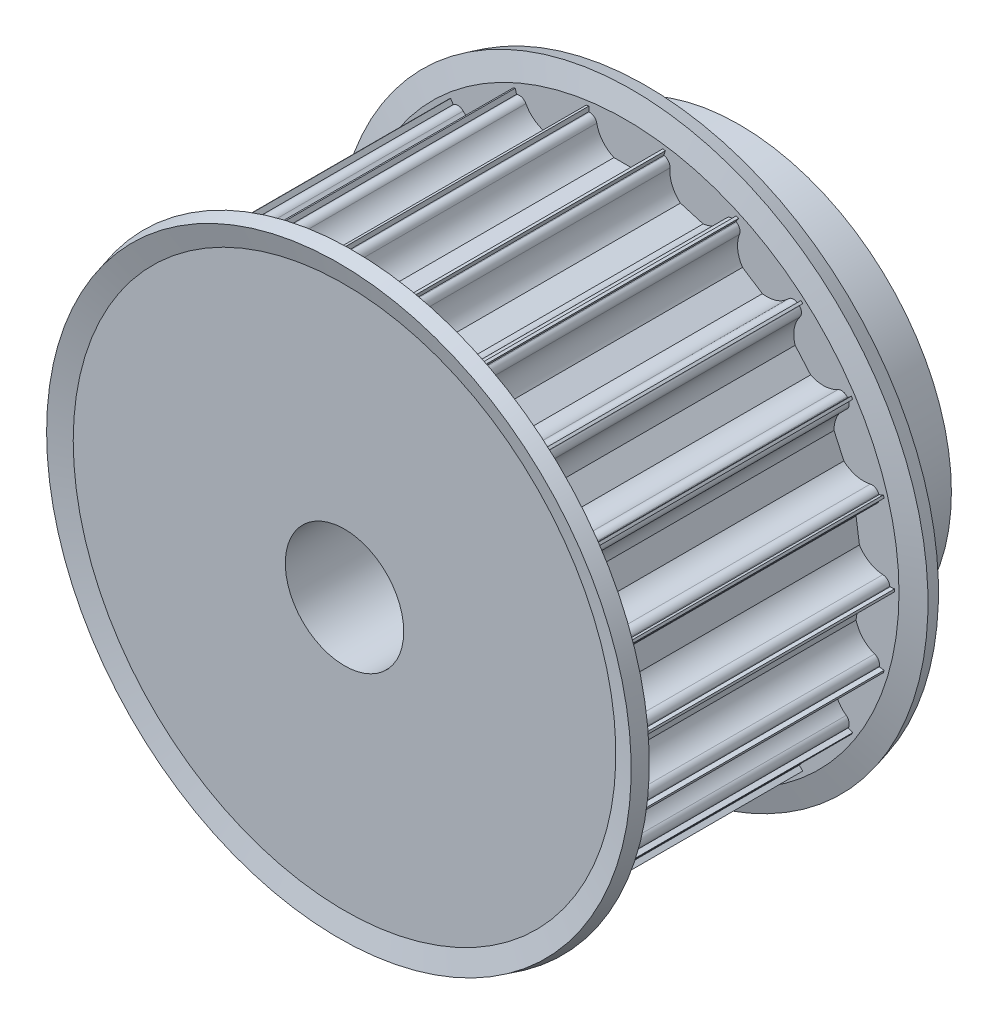
from build123d import *

# Parameters (mm, degrees)
CUT_EXTRUDE1_REACH = 59.861
CIRPATTERN1_COUNT  = 22


with BuildPart() as part:
    # Sketch1 → Revolve1 (revolve)
    with BuildSketch(Plane(origin=(0, 0, 0), x_dir=(0, 0, -1), z_dir=(1, 0, 0)), mode=Mode.PRIVATE) as revolve1_sk:
        Polygon((0, 10.456395349), (40, 10.456395349), (40, 25.956395349), (30, 25.956395349), (30, 31.706395349), (0, 31.706395349), align=None)
    revolve(revolve1_sk.sketch.rotate(Axis((0, 4.456395349, 0), (0, 0, -1)), 90), axis=Axis((0, 4.456395349, 0), (0, 0, -1)))

    # Sketch2 → Cut-Extrude1 (cut, up to next)
    with BuildSketch(Plane.XY, mode=Mode.PRIVATE) as cut_extrude1_sk1:
        with BuildLine():
            Line((-3.674234614, 30.956395349), (-3.75, 30.956395349))
            Line((-3.75, 30.956395349), (-3.75, 32.956395349))
            Line((-3.75, 32.956395349), (3.75, 32.956395349))
            Line((3.75, 32.956395349), (3.75, 30.956395349))
            Line((3.75, 30.956395349), (3.674234614, 30.956395349))
            ThreePointArc((3.674234614, 30.956395349), (3.199892965, 30.787342851), (2.939387691, 30.356395349))
            ThreePointArc((2.939387691, 30.356395349), (2.331759211, 29.06883105), (1.198957881, 28.206395349))
            Line((1.198957881, 28.206395349), (-1.198957881, 28.206395349))
            ThreePointArc((-1.198957881, 28.206395349), (-2.331759211, 29.06883105), (-2.939387691, 30.356395349))
            ThreePointArc((-2.939387691, 30.356395349), (-3.199892965, 30.787342851), (-3.674234614, 30.956395349))
        make_face()
    cut_extrude1_tool1 = extrude(cut_extrude1_sk1.sketch, amount=-CUT_EXTRUDE1_REACH, mode=Mode.PRIVATE) & part.part
    cut_extrude1 = cut_extrude1_tool1.solids().sort_by_distance((0, 30.891564, 0))[0]
    add(cut_extrude1, mode=Mode.SUBTRACT)

    # CirPattern1: Cut-Extrude1 ×22 about axis
    cirpattern1_axis = Axis((0, 4.456395349, 0), (0, 0, 1))
    for i in range(1, CIRPATTERN1_COUNT):
        add(cut_extrude1.rotate(cirpattern1_axis, i * 360 / CIRPATTERN1_COUNT), mode=Mode.SUBTRACT)

    # Sketch3 → Revolve3 (revolve)
    with BuildSketch(Plane(origin=(0, 0, 0), x_dir=(0, 0, -1), z_dir=(1, 0, 0)), mode=Mode.PRIVATE) as revolve3_sk:
        Polygon((30, 25.956395349), (30, 31.948916602), (30.570054448, 34.076388764), (29.121165708, 34.464617332), (28.5, 32.146395349), (28.5, 25.956395349), align=None)
        Polygon((1.5, 32.146395349), (1.5, 25.956395349), (0, 25.956395349), (0, 31.948916602), (-0.570054448, 34.076388764), (0.878834292, 34.464617332), align=None)
    revolve(revolve3_sk.sketch.rotate(Axis((0, 4.456395349, -15), (0, 0, 1)), 90), axis=Axis((0, 4.456395349, -15), (0, 0, 1)))


solid = part.part
